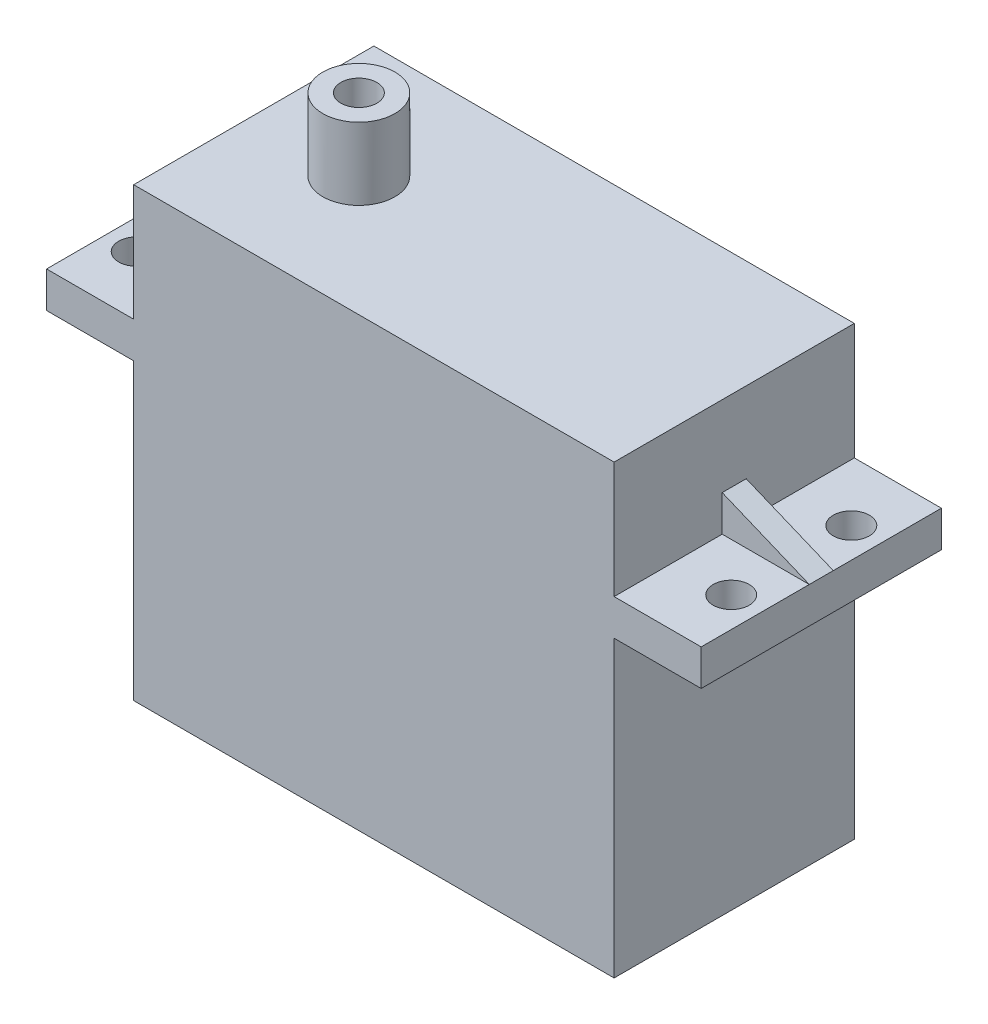
from build123d import *

# Parameters (mm, degrees)
SKETCH_1_W      = 40
SKETCH_1_H      = 20
EXTRUDE_1_DEPTH = 37.2
SKETCH_2_W      = 54.5
SKETCH_2_H      = 20
SKETCH_2_R      = 1.5
EXTRUDE_2_DEPTH = 3
SKETCH_3_R      = 3
SKETCH_3_R_2    = 1.5
EXTRUDE_3_DEPTH = 6
SKETCH_4_W      = 7.126568636
SKETCH_4_H      = 2.078756753
EXTRUDE_4_DEPTH = 3
EXTRUDE_5_DEPTH = 1


with BuildPart() as part:
    # 草图1 → 凸台-拉伸1 (new body)
    with BuildSketch(Plane(origin=(0, 0, 0), x_dir=(1, 0, 0), z_dir=(0, 1, 0))):
        Rectangle(SKETCH_1_W, SKETCH_1_H)
    extrude(amount=EXTRUDE_1_DEPTH)

    # 草图2 → 凸台-拉伸2 (add)
    with BuildSketch(Plane(origin=(0, 24.5, 0), x_dir=(-1, 0, 0), z_dir=(0, -1, 0))):
        Rectangle(SKETCH_2_W, SKETCH_2_H)
        with Locations(Location((-24.75, 5, 0), (0, 0, 90))):
            Circle(SKETCH_2_R, mode=Mode.SUBTRACT)
        with Locations(Location((-24.75, -5, 0), (0, 0, 90))):
            Circle(SKETCH_2_R, mode=Mode.SUBTRACT)
        with Locations(Location((24.75, -5, 0), (0, 0, 90))):
            Circle(SKETCH_2_R, mode=Mode.SUBTRACT)
        with Locations(Location((24.75, 5, 0), (0, 0, 90))):
            Circle(SKETCH_2_R, mode=Mode.SUBTRACT)
    extrude(amount=-EXTRUDE_2_DEPTH)

    # 草图3 → 凸台-拉伸3 (add)
    with BuildSketch(Plane(origin=(0, 37.2, 0), x_dir=(1, 0, 0), z_dir=(0, 1, 0))):
        with Locations(Location((-11.25, 0, 0), (0, 0, 90))):
            Circle(SKETCH_3_R)
        with Locations(Location((-11.25, 0, 0), (0, 0, 270))):
            Circle(SKETCH_3_R_2, mode=Mode.SUBTRACT)
    extrude(amount=EXTRUDE_3_DEPTH)

    # 草图4 → 凸台-拉伸4 (add)
    with BuildSketch(Plane.ZY.offset(20)):
        with Locations((0, 1.039378376)):
            Rectangle(SKETCH_4_W, SKETCH_4_H)
    extrude(amount=EXTRUDE_4_DEPTH)

    # 草图5 → 凸台-拉伸5 (add, symmetric)
    with BuildSketch(Plane.XY):
        Polygon((-27.25, 27.5), (-20, 30.5), (-20, 27.5), align=None)
        Polygon((20, 27.5), (27.25, 27.5), (20, 30.5), align=None)
    extrude(amount=EXTRUDE_5_DEPTH, both=True)


solid = part.part
